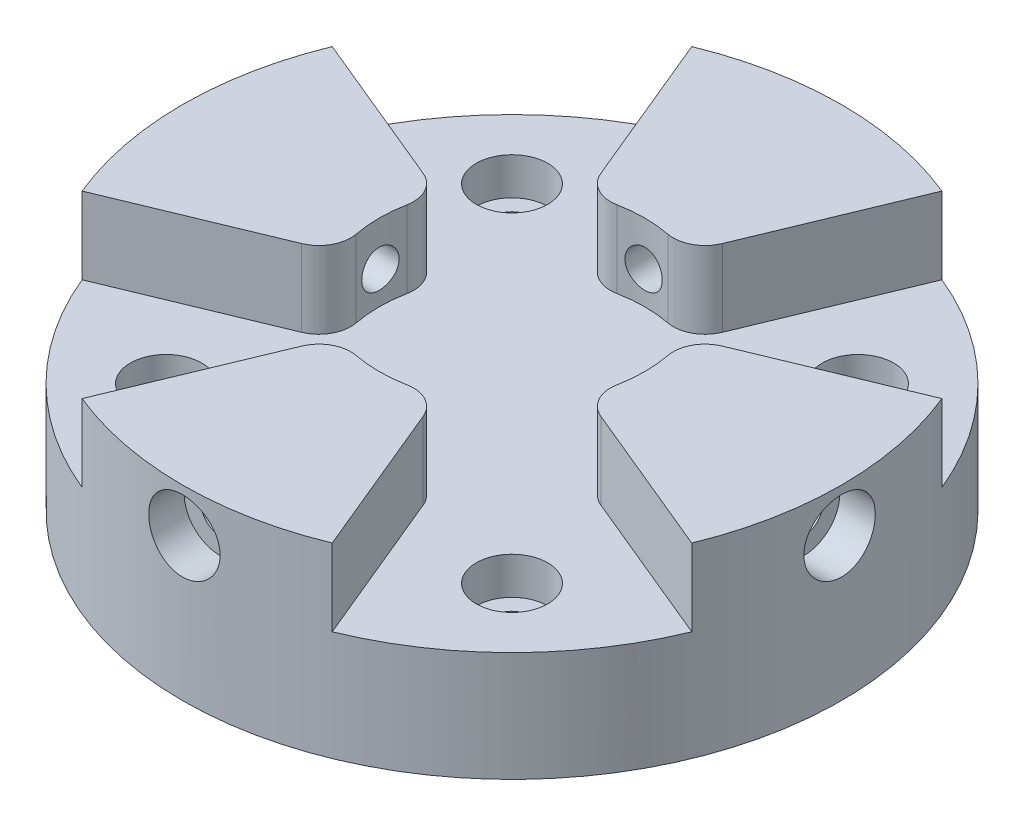
from build123d import *

# Parameters (mm, degrees)
SKETCH1_R                                           = 30
BOSS_EXTRUDE1_DEPTH                                 = 10
CBORE_FOR_M3_HEX_SOCKET_HEAD_CAP_SCREW1_D           = 3.4
CBORE_FOR_M3_HEX_SOCKET_HEAD_CAP_SCREW1_CBORE_D     = 6.5
CBORE_FOR_M3_HEX_SOCKET_HEAD_CAP_SCREW1_CBORE_DEPTH = 3.4
BOSS_EXTRUDE2_DEPTH                                 = 7
CBORE_FOR_M3_HEX_SOCKET_HEAD_CAP_SCREW2_D           = 3.4
CBORE_FOR_M3_HEX_SOCKET_HEAD_CAP_SCREW2_DEPTH       = 18.91444561
CBORE_FOR_M3_HEX_SOCKET_HEAD_CAP_SCREW2_CBORE_D     = 6.5
CBORE_FOR_M3_HEX_SOCKET_HEAD_CAP_SCREW2_CBORE_DEPTH = 3.4
CIRPATTERN1_COUNT                                   = 4
FILLET1_R                                           = 3
CUT_EXTRUDE1_REACH                                  = 47.706
CIRPATTERN2_COUNT                                   = 4


with BuildPart() as part:
    # Sketch1 → Boss-Extrude1 (new body)
    with BuildSketch(Plane(origin=(0, 0, 0), x_dir=(1, 0, 0), z_dir=(0, 1, 0))):
        with Locations(Location((0, 0, 0), (0, 0, 270))):
            Circle(SKETCH1_R)
    extrude(amount=BOSS_EXTRUDE1_DEPTH)

    # CBORE for M3 Hex Socket Head Cap Screw1 (through all)
    with Locations(Plane(origin=(0, 10, 0), x_dir=(1, 0, 0), z_dir=(0, 1, 0))):
        with Locations((15.75, -15.75), (15.75, 15.75), (-15.75, 15.75), (-15.75, -15.75)):
            CounterBoreHole(CBORE_FOR_M3_HEX_SOCKET_HEAD_CAP_SCREW1_D / 2, CBORE_FOR_M3_HEX_SOCKET_HEAD_CAP_SCREW1_CBORE_D / 2, CBORE_FOR_M3_HEX_SOCKET_HEAD_CAP_SCREW1_CBORE_DEPTH)

    # Sketch5 → Boss-Extrude2 (add)
    with BuildSketch(Plane(origin=(0, 10, 0), x_dir=(1, 0, 0), z_dir=(0, 1, 0))):
        with BuildLine():
            ThreePointArc((4.592201188, -11.08655439), (0, -12), (-4.592201188, -11.08655439))
            Line((-4.592201188, -11.08655439), (-11.480502971, -27.716385975))
            ThreePointArc((-11.480502971, -27.716385975), (0, -30), (11.480502971, -27.716385975))
            Line((11.480502971, -27.716385975), (4.592201188, -11.08655439))
        make_face()
    boss_extrude2 = extrude(amount=BOSS_EXTRUDE2_DEPTH)

    # CBORE for M3 Hex Socket Head Cap Screw2
    with Locations(Plane.XY.offset(30)):
        with Locations((0, 13)):
            cbore_for_m3_hex_socket_head_cap_screw2 = CounterBoreHole(CBORE_FOR_M3_HEX_SOCKET_HEAD_CAP_SCREW2_D / 2, CBORE_FOR_M3_HEX_SOCKET_HEAD_CAP_SCREW2_CBORE_D / 2, CBORE_FOR_M3_HEX_SOCKET_HEAD_CAP_SCREW2_CBORE_DEPTH, depth=CBORE_FOR_M3_HEX_SOCKET_HEAD_CAP_SCREW2_DEPTH)

    # CirPattern1: Boss-Extrude2, CBORE for M3 Hex Socket Head Cap Screw2 ×4 about axis
    cirpattern1_axis = Axis((0, 0, 0), (0, 1, 0))
    add([boss_extrude2.rotate(cirpattern1_axis, i * 360 / CIRPATTERN1_COUNT) for i in range(1, CIRPATTERN1_COUNT)])
    add([cbore_for_m3_hex_socket_head_cap_screw2.rotate(cirpattern1_axis, i * 360 / CIRPATTERN1_COUNT) for i in range(1, CIRPATTERN1_COUNT)], mode=Mode.SUBTRACT)

    # Fillet1
    fillet1_edges = [part.edges().sort_by_distance(p)[0] for p in [
        (4.592201188, 13.5, 11.08655439),
        (-4.592201188, 13.5, 11.08655439),
        (11.08655439, 13.5, -4.592201188),
        (11.08655439, 13.5, 4.592201188),
        (-4.592201188, 13.5, -11.08655439),
        (4.592201188, 13.5, -11.08655439),
        (-11.08655439, 13.5, 4.592201188),
        (-11.08655439, 13.5, -4.592201188),
    ]]
    fillet(fillet1_edges, radius=FILLET1_R)

    # Cut-Extrude1: up to this face of the body (flat: up to its plane)
    cut_extrude1_end = Plane(part.part.faces().sort_by_distance((0, 10, 0))[0])
    # Sketch8 → Cut-Extrude1 (cut, up to the picked face)
    with BuildSketch(Plane(origin=(0, 17, 0), x_dir=(1, 0, 0), z_dir=(0, 1, 0)), mode=Mode.PRIVATE) as cut_extrude1_sk1:
        with BuildLine():
            Line((-13.616468974, -5.531886901), (-27.754500338, -11.388051237))
            ThreePointArc((-27.754500338, -11.388051237), (-27.735481678, -11.434292985), (-27.716385975, -11.480502971))
            Line((-27.716385975, -11.480502971), (-13.578200631, -5.624274854))
            ThreePointArc((-13.578200631, -5.624274854), (-12.084036828, -4.273447521), (-11.781000742, -2.282109005))
            ThreePointArc((-11.781000742, -2.282109005), (-12, 0), (-11.781000742, 2.282109005))
            ThreePointArc((-11.781000742, 2.282109005), (-12.084036828, 4.273447521), (-13.578200631, 5.624274854))
            Line((-13.578200631, 5.624274854), (-27.716385975, 11.480502971))
            ThreePointArc((-27.716385975, 11.480502971), (-27.735481678, 11.434292985), (-27.754500338, 11.388051237))
            Line((-27.754500338, 11.388051237), (-13.616468974, 5.531886901))
            ThreePointArc((-13.616468974, 5.531886901), (-12.172110631, 4.226087145), (-11.879175748, 2.30112658))
            ThreePointArc((-11.879175748, 2.30112658), (-12.1, 0), (-11.879175748, -2.30112658))
            ThreePointArc((-11.879175748, -2.30112658), (-12.172110631, -4.226087145), (-13.616468974, -5.531886901))
        make_face()
    cut_extrude1_tool1 = split(extrude(cut_extrude1_sk1.sketch, amount=-CUT_EXTRUDE1_REACH, mode=Mode.PRIVATE), bisect_by=cut_extrude1_end, keep=Keep.BOTH, mode=Mode.PRIVATE)
    cut_extrude1 = cut_extrude1_tool1.solids().sort_by(Axis((-12.147448, 17, 4.239349), (0, -1, 0)))[0]
    add(cut_extrude1, mode=Mode.SUBTRACT)

    # CirPattern2: Cut-Extrude1 ×4 about axis
    cirpattern2_axis = Axis((0, 0, 0), (0, 1, 0))
    for i in range(1, CIRPATTERN2_COUNT):
        add(cut_extrude1.rotate(cirpattern2_axis, i * 360 / CIRPATTERN2_COUNT), mode=Mode.SUBTRACT)


solid = part.part
